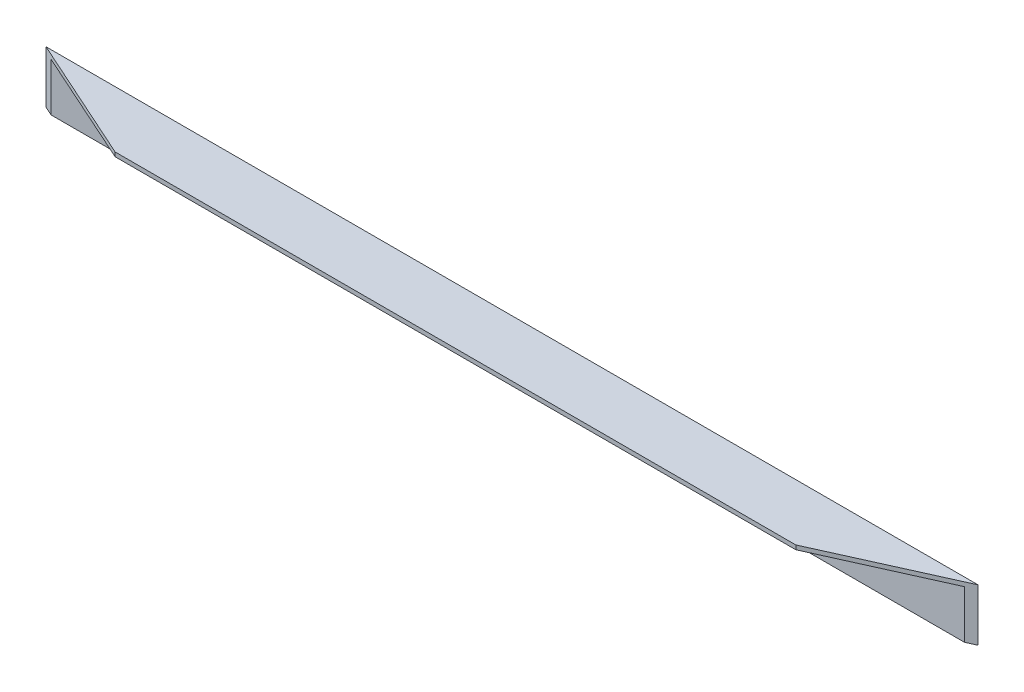
from build123d import *

# Parameters (mm, degrees)
SKETCH_1_W          = 1780
SKETCH_1_H          = 100
EXTRUDE_523_DEPTH   = 8
SKETCH_2_W          = 1780
SKETCH_2_H          = 8
EXTRUDE_1_DEPTH     = 100
CUT_EXTRUDE_1_DEPTH = 903.088687436


with BuildPart() as part:
    # 草图1 → Extrude 523 (new body)
    with BuildSketch(Plane.XY):
        with Locations((0, 50)):
            Rectangle(SKETCH_1_W, SKETCH_1_H)
    extrude(amount=EXTRUDE_523_DEPTH)

    # 草图2 → 凸台-拉伸1 (add)
    with BuildSketch(Plane.XY.offset(8)):
        with Locations((0, 96)):
            Rectangle(SKETCH_2_W, SKETCH_2_H)
    extrude(amount=EXTRUDE_1_DEPTH)

    # 草图3 → 切除-拉伸1 (cut, through all)
    with BuildSketch(Plane(origin=(0, 100, 0), x_dir=(-1, 0, 0), z_dir=(0, 1, 0))):
        Polygon((-650, 108), (-890, 0), (-890, 108), align=None)
        Polygon((890, 108), (650, 108), (890, 0), align=None)
    extrude(amount=-CUT_EXTRUDE_1_DEPTH, mode=Mode.SUBTRACT)


solid = part.part
